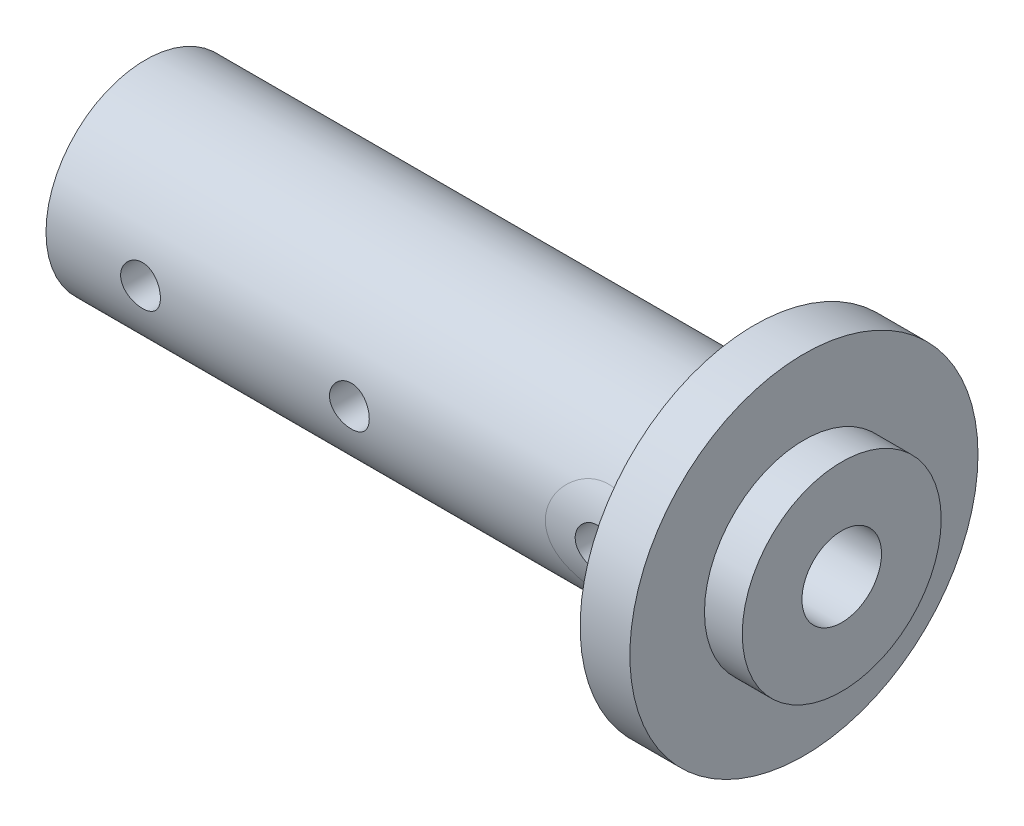
from build123d import *

# Parameters (mm, degrees)
CUT_EXTRUDE2_DEPTH      = 75.246212025
CUT_EXTRUDE2_DEPTH_BACK = 75.246212025
SKETCH5_R               = 2


with BuildPart() as part:
    # Sketch1 → Revolve2 (revolve)
    with BuildSketch(Plane(origin=(0, 0, 0), x_dir=(1, 0, 0), z_dir=(0, 1, 0))):
        Polygon((-3.8, 17.5), (-8.8, 17.5), (-8.8, 10), (-70, 10), (-70, 0), (-70, 4), (0, 4), (0, 10), (-3.8, 10), align=None)
    revolve(axis=Axis((0, 0, 0), (-1, 0, 0)))

    # Sketch5 → Cut-Extrude2 (cut, two sides: drawn at the far end of the back side and taken through both)
    with BuildSketch(Plane.XY.offset(-CUT_EXTRUDE2_DEPTH_BACK)):
        with Locations((-39.5, 0)):
            Circle(SKETCH5_R)
        with Locations((-60.5, 0)):
            Circle(SKETCH5_R)
        with Locations((-14.8, 0)):
            Circle(SKETCH5_R)
    extrude(amount=CUT_EXTRUDE2_DEPTH + CUT_EXTRUDE2_DEPTH_BACK, mode=Mode.SUBTRACT)


solid = part.part
